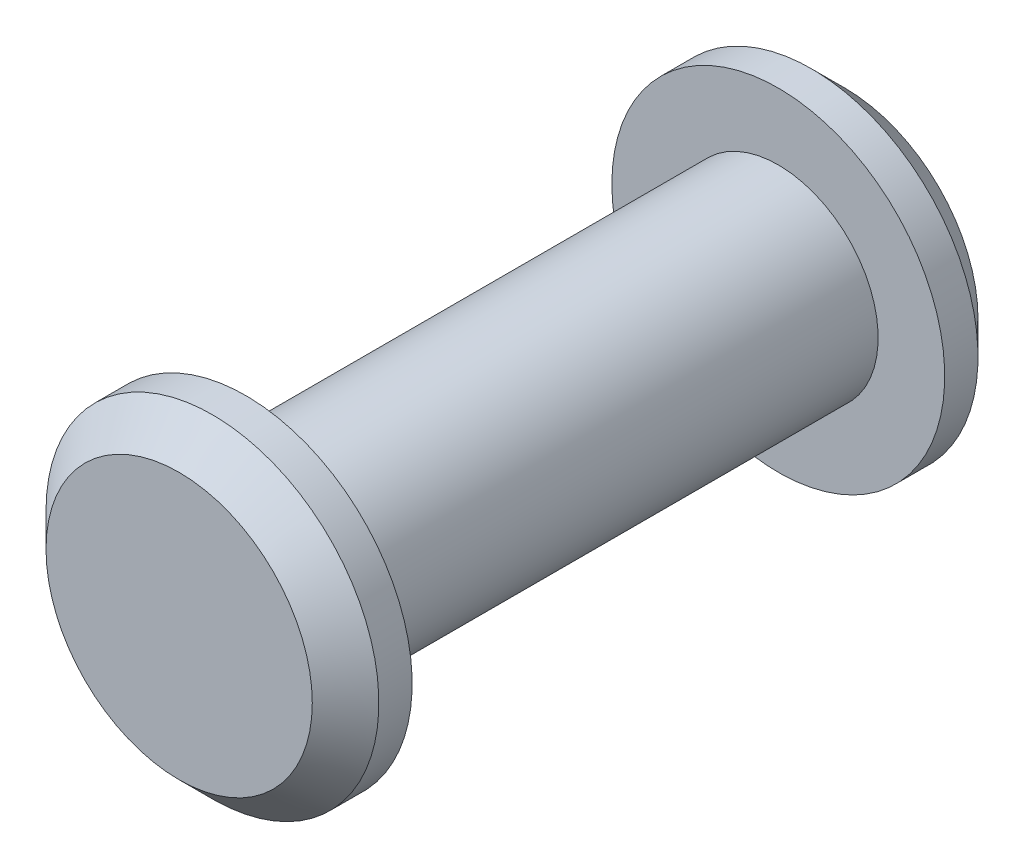
from build123d import *


with BuildPart() as part:
    # Sketch1 → Revolve1 (revolve)
    with BuildSketch(Plane(origin=(0, 0, 0), x_dir=(1, 0, 0), z_dir=(0, 1, 0)), mode=Mode.PRIVATE) as revolve1_sk:
        Polygon((0, 20), (8, 20), (10, 18), (10, 16), (6, 16), (6, -16), (10, -16), (10, -18), (8, -20), (0, -20), align=None)
    revolve(revolve1_sk.sketch.rotate(Axis((0, 0, -20), (0, 0, 1)), 180), axis=Axis((0, 0, -20), (0, 0, 1)))


solid = part.part
